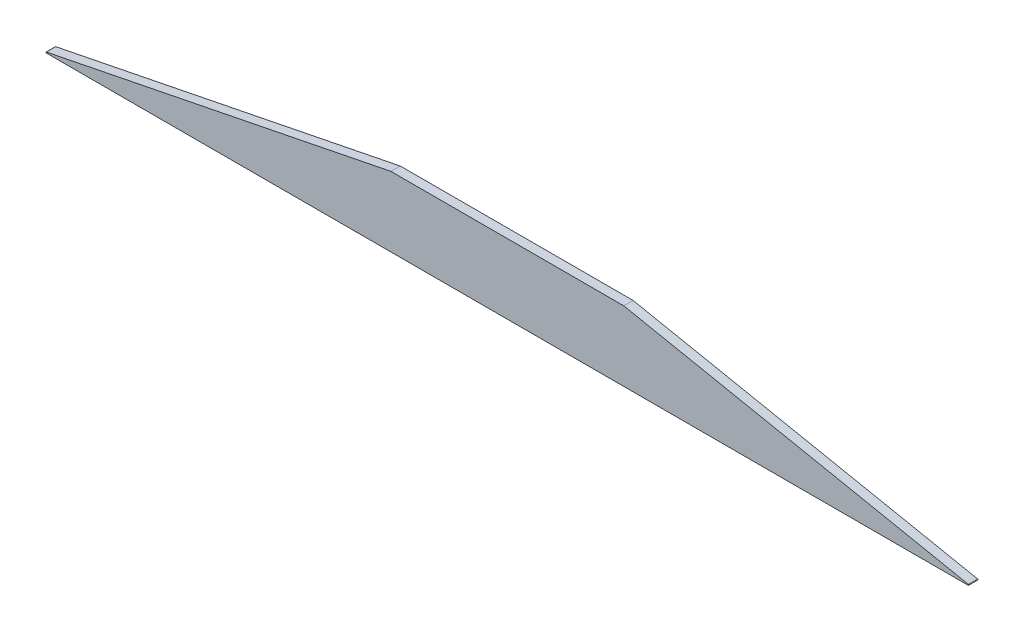
from build123d import *

# Parameters (mm, degrees)
BOSS_EXTRUDE1_DEPTH = 10
FILLET1_R           = 0.5


with BuildPart() as part:
    # Sketch1 → Boss-Extrude1 (new body)
    with BuildSketch(Plane.XY):
        Polygon((-500, 0), (500, 0), (125, 75), (-125, 75), align=None)
    extrude(amount=BOSS_EXTRUDE1_DEPTH)

    # Fillet1
    fillet1_edges = [part.edges().sort_by_distance(p)[0] for p in [
        (500, 0, 5),
        (-500, 0, 5),
    ]]
    fillet(fillet1_edges, radius=FILLET1_R)


solid = part.part
